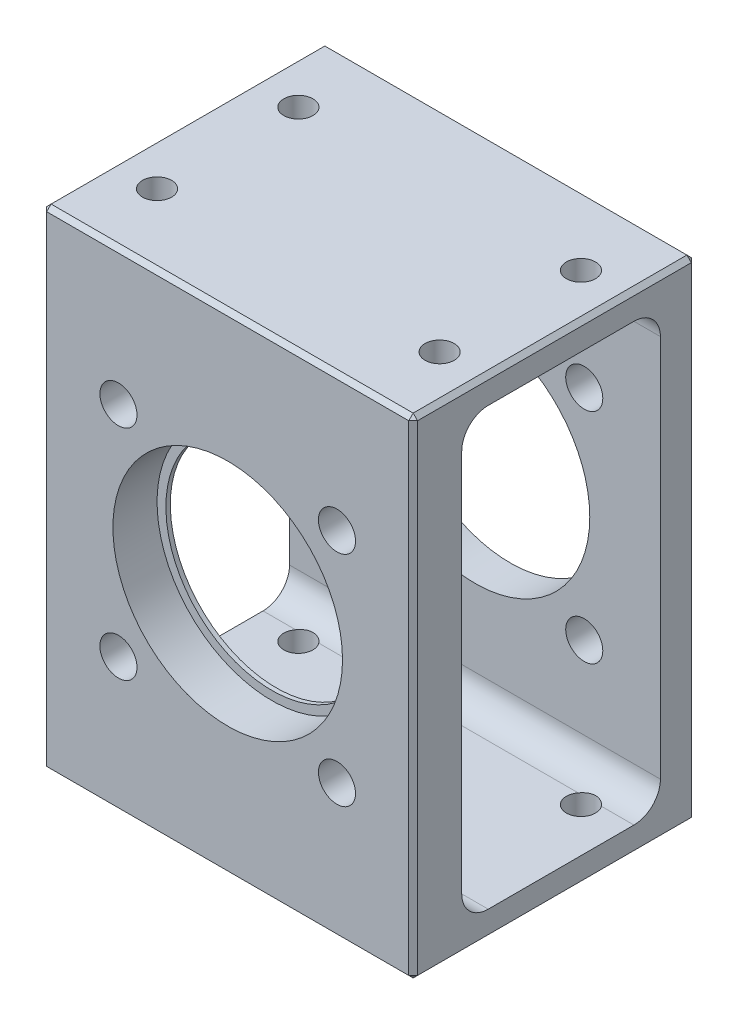
from build123d import *

# Parameters (mm, degrees)
SKETCH_1_W          = 42
SKETCH_1_H          = 32
EXTRUDE_1_DEPTH     = 27.7
SKETCH_2_R          = 13
CUT_EXTRUDE_1_DEPTH = 48.247116314
SKETCH_3_W          = 22.5
SKETCH_3_H          = 49.4
CUT_EXTRUDE_2_DEPTH = 53.79479141
SKETCH_6_R          = 2.1
CUT_EXTRUDE_4_DEPTH = 50
EXTRUDE_START       = -0.5
SKETCH_7_R          = 13
SKETCH_7_R_2        = 12
EXTRUDE_2_DEPTH     = 0.5
FILLET_2_R          = 3
SKETCH_4_R          = 1.25
CUT_EXTRUDE_3_DEPTH = 7
CHAMFER_1_SIZE      = 0.5
HOLE_WIZARD_M4_1_D  = 3.3


with BuildPart() as part:
    # 草图1 → 凸台-拉伸1 (new, symmetric)
    with BuildSketch(Plane(origin=(0, 0, 0), x_dir=(1, 0, 0), z_dir=(0, 1, 0))):
        Rectangle(SKETCH_1_W, SKETCH_1_H)
    extrude(amount=EXTRUDE_1_DEPTH, both=True)

    # 草图2 → 切除-拉伸1 (cut, through all)
    with BuildSketch(Plane.XY.offset(16)):
        Circle(SKETCH_2_R)
    extrude(amount=-CUT_EXTRUDE_1_DEPTH, mode=Mode.SUBTRACT)

    # 草图3 → 切除-拉伸2 (cut, through all)
    with BuildSketch(Plane(origin=(21, 0, 0), x_dir=(0, 0, -1), z_dir=(1, 0, 0))):
        with Locations((0.75, 0)):
            Rectangle(SKETCH_3_W, SKETCH_3_H)
    extrude(amount=-CUT_EXTRUDE_2_DEPTH, mode=Mode.SUBTRACT)

    # 草图6 → 切除-拉伸4 (cut)
    with BuildSketch(Plane.XY.offset(16)):
        with Locations((12.374368671, 12.374368671)):
            Circle(SKETCH_6_R)
        with Locations((-12.374368671, 12.374368671)):
            Circle(SKETCH_6_R)
        with Locations((12.374368671, -12.374368671)):
            Circle(SKETCH_6_R)
        with Locations((-12.374368671, -12.374368671)):
            Circle(SKETCH_6_R)
    extrude(amount=-CUT_EXTRUDE_4_DEPTH, mode=Mode.SUBTRACT)

    # 草图7 → 凸台-拉伸2 (add)
    with BuildSketch(Plane(origin=(0, 0, 10.5), x_dir=(-1, 0, 0), z_dir=(0, 0, -1)).offset(EXTRUDE_START)):
        with Locations(Location((0, 0, 0), (0, 0, 180))):
            Circle(SKETCH_7_R)
        with Locations(Location((0, 0, 0), (0, 0, 90))):
            Circle(SKETCH_7_R_2, mode=Mode.SUBTRACT)
    extrude(amount=EXTRUDE_2_DEPTH)

    # 圆角2
    fillet_2_edges = [part.edges().sort_by_distance(p)[0] for p in [
        (0, -24.7, 10.5),
        (0, 24.7, -12),
        (0, 24.7, 10.5),
        (0, -24.7, -12),
    ]]
    fillet(fillet_2_edges, radius=FILLET_2_R)

    # 草图4 → 切除-拉伸3 (cut)
    with BuildSketch(Plane(origin=(0, 27.7, 0), x_dir=(1, 0, 0), z_dir=(0, 1, 0))):
        with Locations(Location((-16, 8, 0), (0, 0, 270))):
            Circle(SKETCH_4_R)
        with Locations(Location((16, 8, 0), (0, 0, 270))):
            Circle(SKETCH_4_R)
        with Locations(Location((-16, -8, 0), (0, 0, 270))):
            Circle(SKETCH_4_R)
        with Locations(Location((16, -8, 0), (0, 0, 270))):
            Circle(SKETCH_4_R)
    cut_extrude_3 = extrude(amount=-CUT_EXTRUDE_3_DEPTH, mode=Mode.SUBTRACT)

    # 镜向1: 切除-拉伸3 across plane
    add(cut_extrude_3.mirror(Plane.ZX), mode=Mode.SUBTRACT)

    # 倒角1
    chamfer_1_edges = [part.edges().sort_by_distance(p)[0] for p in [
        (-21, 27.7, 0),
        (0, 27.7, 16),
        (21, 27.7, 0),
        (0, -27.7, 16),
        (-21, -27.7, 0),
        (0, -27.7, -16),
        (21, -27.7, 0),
        (0, 27.7, -16),
        (21, 0, 16),
        (-21, 0, 16),
        (-21, 0, -16),
        (21, 0, -16),
    ]]
    chamfer(chamfer_1_edges, length=CHAMFER_1_SIZE)

    # M4 螺纹孔1 (through all)
    with Locations(Plane(origin=(0, 27.7, 0), x_dir=(1, 0, 0), z_dir=(0, 1, 0))):
        with Locations((16, -8), (16, 8), (-16, 8), (-16, -8)):
            Hole(HOLE_WIZARD_M4_1_D / 2)


solid = part.part
